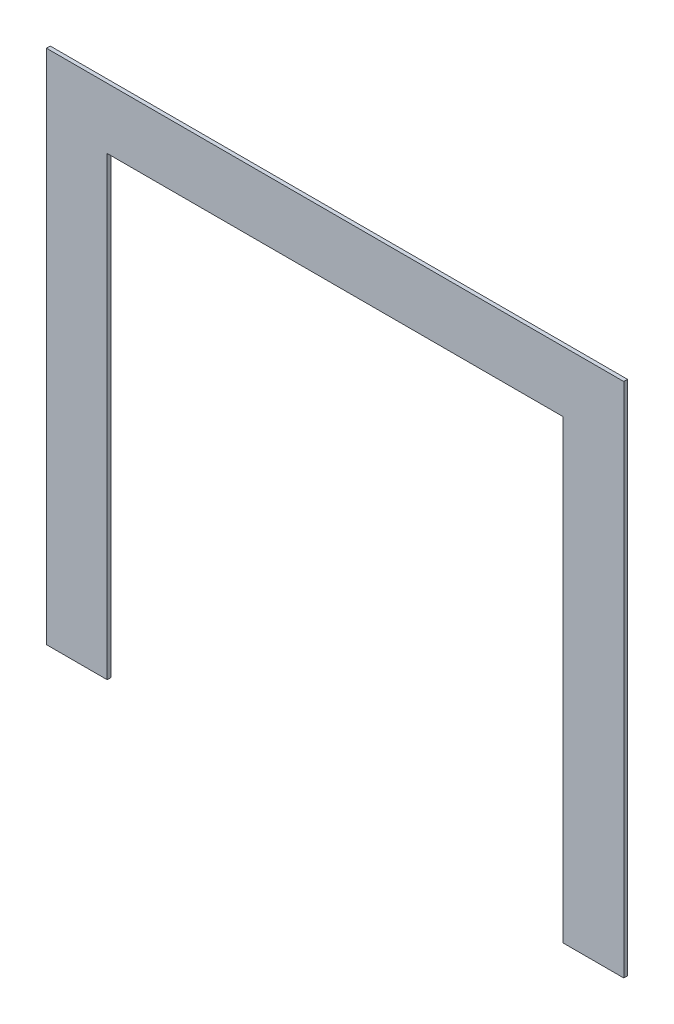
from build123d import *

# Parameters (mm, degrees)
SKETCH1_W           = 482.6
SKETCH1_H           = 431.8
BOSS_EXTRUDE1_DEPTH = 3.175
SKETCH2_W           = 381
SKETCH2_H           = 381
CUT_EXTRUDE1_DEPTH  = 3.175


with BuildPart() as part:
    # Sketch1 → Boss-Extrude1 (new body)
    with BuildSketch(Plane.XY):
        with Locations((241.3, 215.9)):
            Rectangle(SKETCH1_W, SKETCH1_H)
    extrude(amount=BOSS_EXTRUDE1_DEPTH)

    # Sketch2 → Cut-Extrude1 (cut)
    with BuildSketch(Plane.XY.offset(3.175)):
        with Locations((241.3, 190.5)):
            Rectangle(SKETCH2_W, SKETCH2_H)
    extrude(amount=-CUT_EXTRUDE1_DEPTH, mode=Mode.SUBTRACT)


solid = part.part
